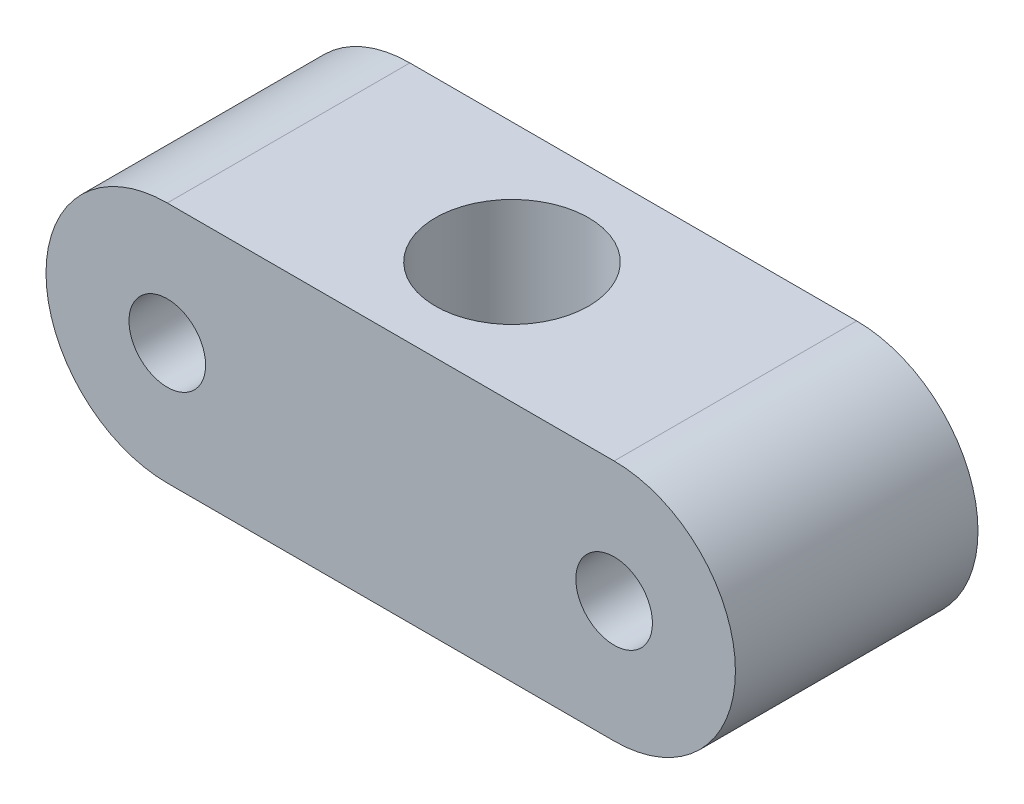
from build123d import *

# Parameters (mm, degrees)
SKETCH1_R           = 6
BOSS_EXTRUDE1_DEPTH = 19
SKETCH2_R           = 12
CUT_EXTRUDE1_DEPTH  = 69.709533545


with BuildPart() as part:
    # Sketch1 → Boss-Extrude1 (new, symmetric)
    with BuildSketch(Plane.XY):
        with BuildLine():
            Line((-35, 19), (35, 19))
            ThreePointArc((35, 19), (54, 0), (35, -19))
            Line((35, -19), (-35, -19))
            ThreePointArc((-35, -19), (-54, 0), (-35, 19))
        make_face()
        with Locations((-35, 0)):
            Circle(SKETCH1_R, mode=Mode.SUBTRACT)
        with Locations((35, 0)):
            Circle(SKETCH1_R, mode=Mode.SUBTRACT)
    extrude(amount=BOSS_EXTRUDE1_DEPTH, both=True)

    # Sketch2 → Cut-Extrude1 (cut, through all)
    with BuildSketch(Plane.XZ.offset(19)):
        Circle(SKETCH2_R)
    extrude(amount=-CUT_EXTRUDE1_DEPTH, mode=Mode.SUBTRACT)


solid = part.part
